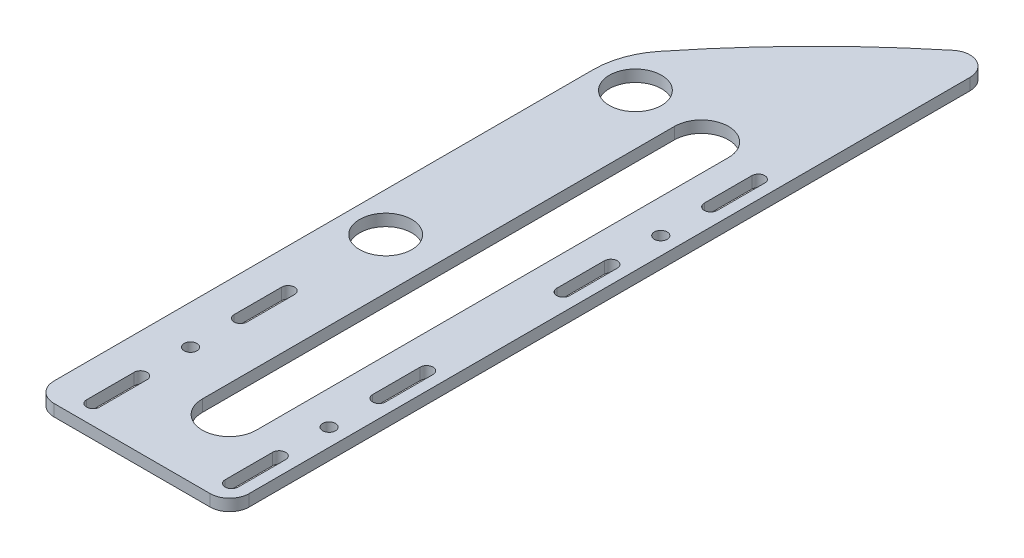
from build123d import *

# Parameters (mm, degrees)
SKETCH_1_R          = 6.7
SKETCH_1_R_2        = 1.650002274
SKETCH_1_R_3        = 1.65
EXTRUDE_1_DEPTH     = 3
FILLET_1_R          = 5
FILLET_2_R          = 20
CUT_EXTRUDE_1_DEPTH = 202.075524607


with BuildPart() as part:
    # 草图1 → 凸台-拉伸1 (new body)
    with BuildSketch(Plane(origin=(0, 0, 0), x_dir=(1, 0, 0), z_dir=(0, 1, 0))):
        with BuildLine():
            Line((0, 0), (50, 0))
            Line((50, 0), (50, 200))
            ThreePointArc((50, 200), (23.223304703, 176.776695297), (0, 150))
            Line((0, 150), (0, 0))
        make_face()
        with Locations(Location((10, 80, 0), (0, 0, 270))):
            Circle(SKETCH_1_R, mode=Mode.SUBTRACT)
        with Locations(Location((10, 144, 0), (0, 0, 270))):
            Circle(SKETCH_1_R, mode=Mode.SUBTRACT)
        with Locations(Location((10, 30, 0), (0, 0, 270))):
            Circle(SKETCH_1_R_2, mode=Mode.SUBTRACT)
        with Locations(Location((45.5, 30, 0), (0, 0, 270))):
            Circle(SKETCH_1_R_3, mode=Mode.SUBTRACT)
        with Locations(Location((45.5, 115, 0), (0, 0, 270))):
            Circle(SKETCH_1_R_3, mode=Mode.SUBTRACT)
        with BuildLine():
            Line((8.35, 5), (8.35, 17.2))
            ThreePointArc((8.35, 17.2), (10, 18.85), (11.65, 17.2))
            Line((11.65, 17.2), (11.65, 5))
            ThreePointArc((11.65, 5), (10, 3.35), (8.35, 5))
        make_face(mode=Mode.SUBTRACT)
        with BuildLine():
            Line((8.35, 42.8), (8.35, 55))
            ThreePointArc((8.35, 55), (10, 56.65), (11.65, 55))
            Line((11.65, 55), (11.65, 42.8))
            ThreePointArc((11.65, 42.8), (10, 41.15), (8.35, 42.8))
        make_face(mode=Mode.SUBTRACT)
        with BuildLine():
            Line((43.85, 5), (43.85, 17.2))
            ThreePointArc((43.85, 17.2), (45.5, 18.85), (47.15, 17.2))
            Line((47.15, 17.2), (47.15, 5))
            ThreePointArc((47.15, 5), (45.5, 3.35), (43.85, 5))
        make_face(mode=Mode.SUBTRACT)
        with BuildLine():
            Line((43.85, 42.8), (43.85, 55))
            ThreePointArc((43.85, 55), (45.5, 56.65), (47.15, 55))
            Line((47.15, 55), (47.15, 42.8))
            ThreePointArc((47.15, 42.8), (45.5, 41.15), (43.85, 42.8))
        make_face(mode=Mode.SUBTRACT)
        with BuildLine():
            Line((43.85, 90), (43.85, 102.2))
            ThreePointArc((43.85, 102.2), (45.5, 103.85), (47.15, 102.2))
            Line((47.15, 102.2), (47.15, 90))
            ThreePointArc((47.15, 90), (45.5, 88.35), (43.85, 90))
        make_face(mode=Mode.SUBTRACT)
        with BuildLine():
            Line((43.85, 127.8), (43.85, 140))
            ThreePointArc((43.85, 140), (45.5, 141.65), (47.15, 140))
            Line((47.15, 140), (47.15, 127.8))
            ThreePointArc((47.15, 127.8), (45.5, 126.15), (43.85, 127.8))
        make_face(mode=Mode.SUBTRACT)
    extrude(amount=EXTRUDE_1_DEPTH)

    # 圆角1
    fillet_1_edges = [part.edges().sort_by_distance(p)[0] for p in [
        (50, 1.5, -200),
        (50, 1.5, 0),
        (0, 1.5, 0),
    ]]
    fillet(fillet_1_edges, radius=FILLET_1_R)

    # 圆角2
    fillet_2_edges = [part.edges().sort_by_distance(p)[0] for p in [
        (0, 1.5, -150),
    ]]
    fillet(fillet_2_edges, radius=FILLET_2_R)

    # 草图2 → 切除-拉伸1 (cut, through all)
    with BuildSketch(Plane(origin=(0, 3, 0), x_dir=(1, 0, 0), z_dir=(0, 1, 0))):
        with BuildLine():
            Line((36.85, 141), (36.85, 20))
            ThreePointArc((36.85, 20), (29.925, 13.075), (23, 20))
            Line((23, 20), (23, 141))
            ThreePointArc((23, 141), (29.925, 147.925), (36.85, 141))
        make_face()
    extrude(amount=-CUT_EXTRUDE_1_DEPTH, mode=Mode.SUBTRACT)


solid = part.part
